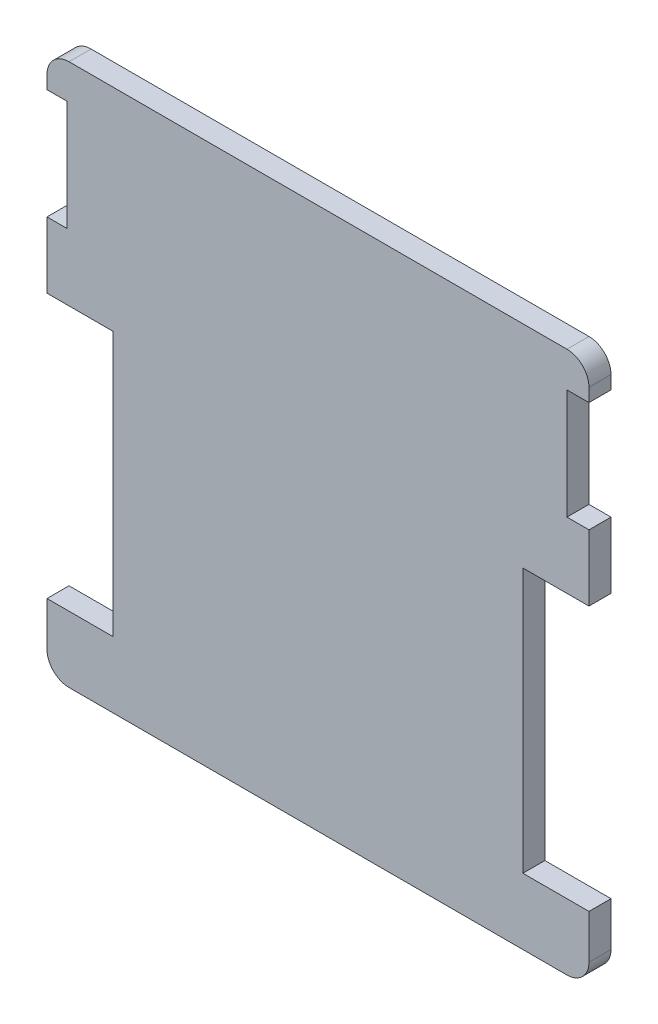
from build123d import *

# Parameters (mm, degrees)
RESSALTO_EXTRUS_O1_DEPTH = 5
ESBO_O4_W                = 4.495494134
ESBO_O4_H                = 25
CORTE_EXTRUS_O2_DEPTH    = 5
ESBO_O11_W               = 5
ESBO_O11_H               = 25
CORTE_EXTRUS_O8_DEPTH    = 10
ESBO_O24_W               = 15
ESBO_O24_H               = 60
CORTE_EXTRUS_O14_DEPTH   = 10
ESBO_O27_W               = 15
ESBO_O27_H               = 60
CORTE_EXTRUS_O16_DEPTH   = 25


with BuildPart() as part:
    # Esboço1 → Ressalto-extrusão1 (new body)
    with BuildSketch(Plane.XY):
        with BuildLine():
            Line((-47.810925728, 58.485502959), (65.189074272, 58.485502959))
            ThreePointArc((65.189074272, 58.485502959), (68.724608178, 57.021036865), (70.189074272, 53.485502959))
            Line((70.189074272, 53.485502959), (70.189074272, -59.514497041))
            ThreePointArc((70.189074272, -59.514497041), (68.724608178, -63.050030947), (65.189074272, -64.514497041))
            Line((65.189074272, -64.514497041), (-47.810925728, -64.514497041))
            ThreePointArc((-47.810925728, -64.514497041), (-51.346459634, -63.050030947), (-52.810925728, -59.514497041))
            Line((-52.810925728, -59.514497041), (-52.810925728, 53.485502959))
            ThreePointArc((-52.810925728, 53.485502959), (-51.346459634, 57.021036865), (-47.810925728, 58.485502959))
        make_face()
    extrude(amount=RESSALTO_EXTRUS_O1_DEPTH)

    # Esboço4 → Corte-extrusão2 (cut)
    with BuildSketch(Plane.XY.offset(5)):
        with Locations((-50.563178661, 37.985502959)):
            Rectangle(ESBO_O4_W, ESBO_O4_H)
    extrude(amount=-CORTE_EXTRUS_O2_DEPTH, mode=Mode.SUBTRACT)

    # Esboço11 → Corte-extrusão8 (cut)
    with BuildSketch(Plane.XY.offset(5)):
        with Locations((67.689074272, 37.985502959)):
            Rectangle(ESBO_O11_W, ESBO_O11_H)
    extrude(amount=-CORTE_EXTRUS_O8_DEPTH, mode=Mode.SUBTRACT)

    # Esboço24 → Corte-extrusão14 (cut)
    with BuildSketch(Plane.XY.offset(5)):
        with Locations((-45.310925728, -19.514497041)):
            Rectangle(ESBO_O24_W, ESBO_O24_H)
    extrude(amount=-CORTE_EXTRUS_O14_DEPTH, mode=Mode.SUBTRACT)

    # Esboço27 → Corte-extrusão16 (cut)
    with BuildSketch(Plane.XY.offset(5)):
        with Locations((62.689074272, -19.514497041)):
            Rectangle(ESBO_O27_W, ESBO_O27_H)
    extrude(amount=-CORTE_EXTRUS_O16_DEPTH, mode=Mode.SUBTRACT)


solid = part.part
